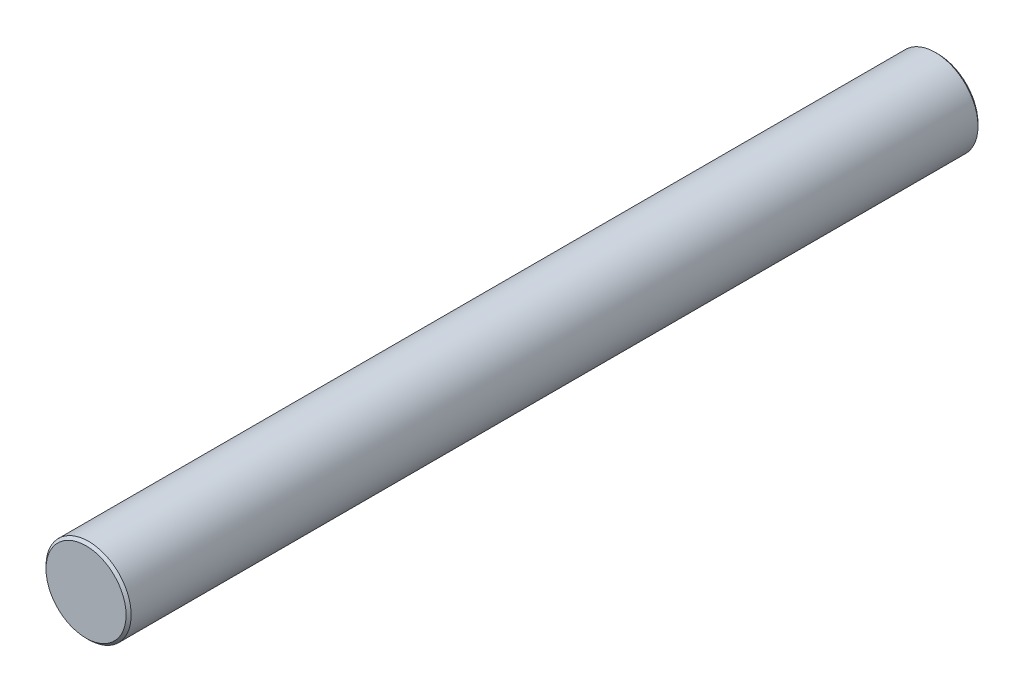
from build123d import *

# Parameters (mm, degrees)
SKETCH1_R           = 5
BOSS_EXTRUDE1_DEPTH = 50
CHAMFER1_SIZE       = 0.3


with BuildPart() as part:
    # Sketch1 → Boss-Extrude1 (new, symmetric)
    with BuildSketch(Plane.XY):
        with Locations(Location((0, 0, 0), (0, 0, 180))):
            Circle(SKETCH1_R)
    extrude(amount=BOSS_EXTRUDE1_DEPTH, both=True)

    # Chamfer1
    chamfer1_edges = [part.edges().sort_by_distance(p)[0] for p in [
        (5, 0, -50),
        (5, 0, 50),
    ]]
    chamfer(chamfer1_edges, length=CHAMFER1_SIZE)


solid = part.part
